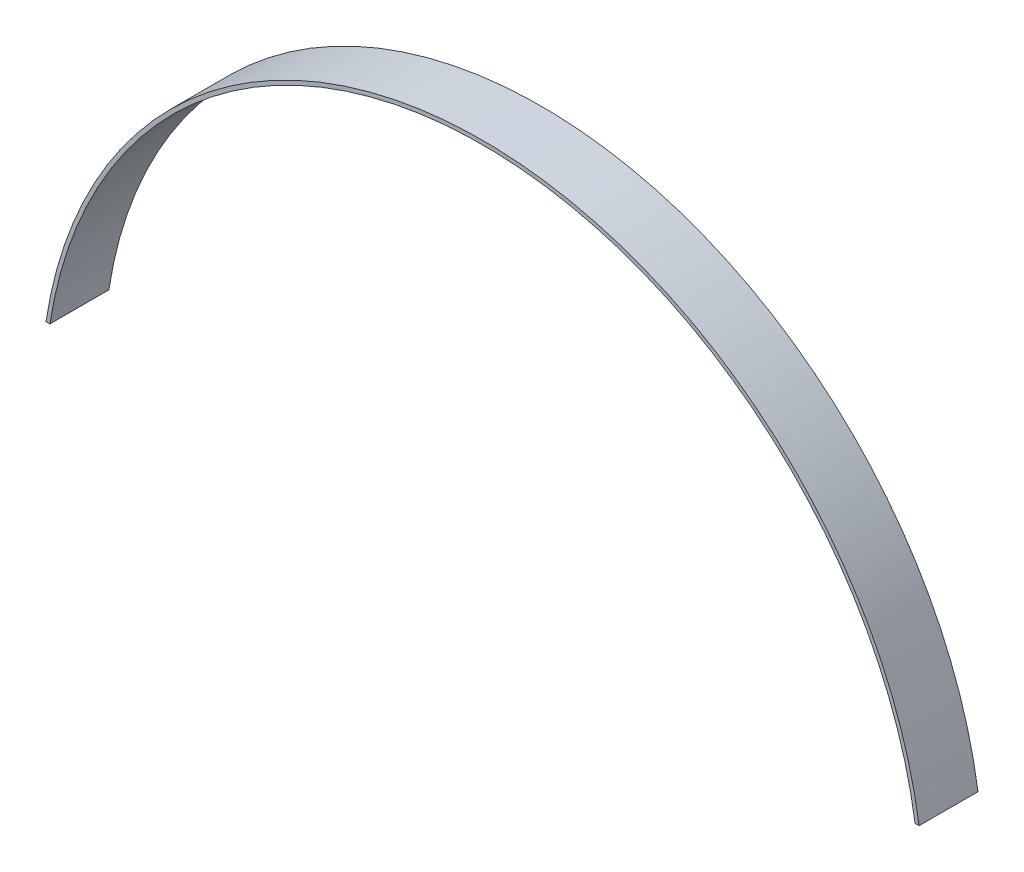
from build123d import *

# Parameters (mm, degrees)
BOSS_EXTRUDE1_DEPTH = 15


with BuildPart() as part:
    # Sketch1 → Boss-Extrude1 (new body)
    with BuildSketch(Plane.XY):
        with BuildLine():
            Line((130.675258393, -54.153767369), (131.686791854, -54.153767369))
            ThreePointArc((131.686791854, -54.153767369), (20.507469998, 41.43913597), (-90.671851857, -54.153767369))
            Line((-90.671851857, -54.153767369), (-89.660318396, -54.153767369))
            ThreePointArc((-89.660318396, -54.153767369), (20.507469998, 40.43913597), (130.675258393, -54.153767369))
        make_face()
    extrude(amount=BOSS_EXTRUDE1_DEPTH)


solid = part.part
